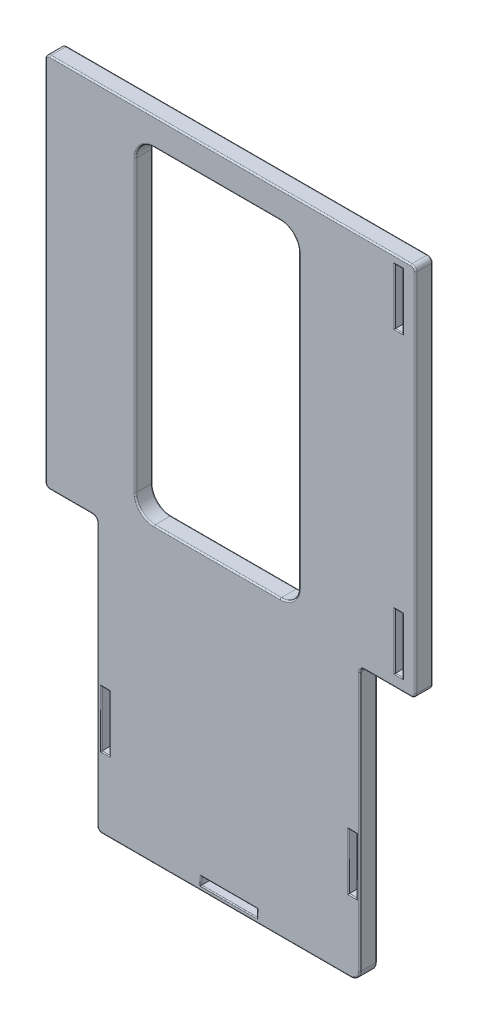
from build123d import *

# Parameters (mm, degrees)
BOSS_EXTRUDE1_DEPTH = 3.7
SKETCH2_W           = 1.7
SKETCH2_H           = 12
SKETCH2_W_2         = 12
SKETCH2_H_2         = 1.7
CUT_EXTRUDE1_DEPTH  = 4
FILLET1_R           = 0.3
FILLET2_R           = 0.2


with BuildPart() as part:
    # Sketch1 → Boss-Extrude1 (new body)
    with BuildSketch(Plane.XY):
        with BuildLine():
            Line((25.47092131, 239.333331526), (35.393009955, 239.333331526))
            ThreePointArc((35.393009955, 239.333331526), (36.100116737, 239.626224745), (36.393009955, 240.333331526))
            Line((36.393009955, 240.333331526), (36.393009955, 318.489057253))
            ThreePointArc((36.393009955, 318.489057253), (36.100116737, 319.196164034), (35.393009955, 319.489057253))
            Line((35.393009955, 319.489057253), (-41.856990045, 319.489057253))
            ThreePointArc((-41.856990045, 319.489057253), (-42.564096826, 319.196164034), (-42.856990045, 318.489057253))
            Line((-42.856990045, 318.489057253), (-42.856990045, 240.083331526))
            ThreePointArc((-42.856990045, 240.083331526), (-42.564096826, 239.376224745), (-41.856990045, 239.083331526))
            Line((-41.856990045, 239.083331526), (-32.758604141, 239.083331526))
            ThreePointArc((-32.758604141, 239.083331526), (-32.05149736, 238.790438307), (-31.758604141, 238.083331526))
            Line((-31.758604141, 238.083331526), (-31.758604141, 181.889057196))
            ThreePointArc((-31.758604141, 181.889057196), (-31.465710922, 181.181950415), (-30.758604141, 180.889057196))
            Line((-30.758604141, 180.889057196), (22.47092131, 180.889057196))
            ThreePointArc((22.47092131, 180.889057196), (23.885134873, 181.474843634), (24.47092131, 182.889057196))
            Line((24.47092131, 182.889057196), (24.47092131, 238.333331526))
            ThreePointArc((24.47092131, 238.333331526), (24.763814529, 239.040438307), (25.47092131, 239.333331526))
        make_face()
        with BuildLine():
            Line((-19.56052606, 313.632292469), (7.43947394, 313.632292469))
            ThreePointArc((7.43947394, 313.632292469), (10.267901064, 312.460719594), (11.43947394, 309.632292469))
            Line((11.43947394, 309.632292469), (11.43947394, 247.632292469))
            ThreePointArc((11.43947394, 247.632292469), (10.267901064, 244.803865345), (7.43947394, 243.632292469))
            Line((7.43947394, 243.632292469), (-19.56052606, 243.632292469))
            ThreePointArc((-19.56052606, 243.632292469), (-22.388953185, 244.803865345), (-23.56052606, 247.632292469))
            Line((-23.56052606, 247.632292469), (-23.56052606, 309.632292469))
            ThreePointArc((-23.56052606, 309.632292469), (-22.388953185, 312.460719594), (-19.56052606, 313.632292469))
        make_face(mode=Mode.SUBTRACT)
    extrude(amount=BOSS_EXTRUDE1_DEPTH)

    # Sketch2 → Cut-Extrude1 (cut)
    with BuildSketch(Plane(origin=(0, 0, 0), x_dir=(-1, 0, 0), z_dir=(0, 0, -1))):
        with Locations((29.979078689, 202.141797546)):
            Rectangle(SKETCH2_W, SKETCH2_H)
        with Locations((3.52907869, 182.759057196)):
            Rectangle(SKETCH2_W_2, SKETCH2_H_2)
        with Locations((-22.92092131, 202.141797546)):
            Rectangle(SKETCH2_W, SKETCH2_H)
        with Locations((-32.781605347, 247.889057196)):
            Rectangle(SKETCH2_W, SKETCH2_H)
        with Locations((-32.781605347, 311.789057196)):
            Rectangle(SKETCH2_W, SKETCH2_H)
    extrude(amount=-CUT_EXTRUDE1_DEPTH, mode=Mode.SUBTRACT)

    # Fillet1
    fillet1_edges = [part.edges().sort_by_distance(p)[0] for p in [
        (24.763814529, 239.040438307, 3.7),
        (-4.143841415, 180.889057196, 0),
        (-31.465710922, 181.181950415, 0),
        (-31.758604141, 209.986194361, 0),
        (30.431965633, 239.333331526, 3.7),
        (-32.05149736, 238.790438307, 0),
        (-37.307797093, 239.083331526, 0),
        (-42.564096826, 239.376224745, 0),
        (-42.856990045, 279.286194389, 0),
        (-42.564096826, 319.196164034, 0),
        (-3.231990045, 319.489057253, 0),
        (36.100116737, 319.196164034, 0),
        (36.393009955, 279.411194389, 0),
        (36.100116737, 239.626224745, 0),
        (30.431965633, 239.333331526, 0),
        (36.100116737, 239.626224745, 3.7),
        (24.763814529, 239.040438307, 0),
        (24.47092131, 210.611194361, 0),
        (23.885134873, 181.474843634, 0),
        (36.393009955, 279.411194389, 3.7),
        (36.100116737, 319.196164034, 3.7),
        (-3.231990045, 319.489057253, 3.7),
        (-42.564096826, 319.196164034, 3.7),
        (-42.856990045, 279.286194389, 3.7),
        (-42.564096826, 239.376224745, 3.7),
        (-22.388953185, 244.803865345, 0),
        (-6.06052606, 243.632292469, 0),
        (10.267901064, 244.803865345, 0),
        (11.43947394, 278.632292469, 0),
        (10.267901064, 312.460719594, 0),
        (-6.06052606, 313.632292469, 0),
        (-22.388953185, 312.460719594, 0),
        (-23.56052606, 278.632292469, 0),
        (-37.307797093, 239.083331526, 3.7),
        (-22.388953185, 244.803865345, 3.7),
        (-6.06052606, 243.632292469, 3.7),
        (10.267901064, 244.803865345, 3.7),
        (23.885134873, 181.474843634, 3.7),
        (11.43947394, 278.632292469, 3.7),
        (10.267901064, 312.460719594, 3.7),
        (-6.06052606, 313.632292469, 3.7),
        (-22.388953185, 312.460719594, 3.7),
        (-23.56052606, 278.632292469, 3.7),
        (-32.05149736, 238.790438307, 3.7),
        (-31.758604141, 209.986194361, 3.7),
        (-31.465710922, 181.181950415, 3.7),
        (-4.143841415, 180.889057196, 3.7),
        (24.47092131, 210.611194361, 3.7),
    ]]
    fillet(fillet1_edges, radius=FILLET1_R)

    # Fillet2
    fillet2_edges = [part.edges().sort_by_distance(p)[0] for p in [
        (-3.52907869, 183.609057196, 3.7),
        (-9.52907869, 182.759057196, 3.7),
        (-3.52907869, 181.909057196, 3.7),
        (2.47092131, 182.759057196, 3.7),
        (-3.52907869, 183.609057196, 0),
        (2.47092131, 182.759057196, 0),
        (-3.52907869, 181.909057196, 0),
        (-9.52907869, 182.759057196, 0),
        (23.77092131, 202.141797546, 3.7),
        (22.92092131, 208.141797546, 3.7),
        (22.07092131, 202.141797546, 3.7),
        (22.92092131, 196.141797546, 3.7),
        (23.77092131, 202.141797546, 0),
        (22.92092131, 196.141797546, 0),
        (22.07092131, 202.141797546, 0),
        (22.92092131, 208.141797546, 0),
        (33.631605347, 247.889057196, 3.7),
        (32.781605347, 253.889057196, 3.7),
        (31.931605347, 247.889057196, 3.7),
        (32.781605347, 241.889057196, 3.7),
        (33.631605347, 247.889057196, 0),
        (32.781605347, 241.889057196, 0),
        (31.931605347, 247.889057196, 0),
        (32.781605347, 253.889057196, 0),
        (32.781605347, 305.789057196, 3.7),
        (33.631605347, 311.789057196, 3.7),
        (32.781605347, 317.789057196, 3.7),
        (31.931605347, 311.789057196, 3.7),
        (32.781605347, 305.789057196, 0),
        (31.931605347, 311.789057196, 0),
        (32.781605347, 317.789057196, 0),
        (33.631605347, 311.789057196, 0),
        (-29.979078689, 208.141797546, 3.7),
        (-30.829078689, 202.141797546, 3.7),
        (-29.979078689, 196.141797546, 3.7),
        (-29.129078689, 202.141797546, 3.7),
        (-29.979078689, 208.141797546, 0),
        (-29.129078689, 202.141797546, 0),
        (-29.979078689, 196.141797546, 0),
        (-30.829078689, 202.141797546, 0),
    ]]
    fillet(fillet2_edges, radius=FILLET2_R)


solid = part.part
